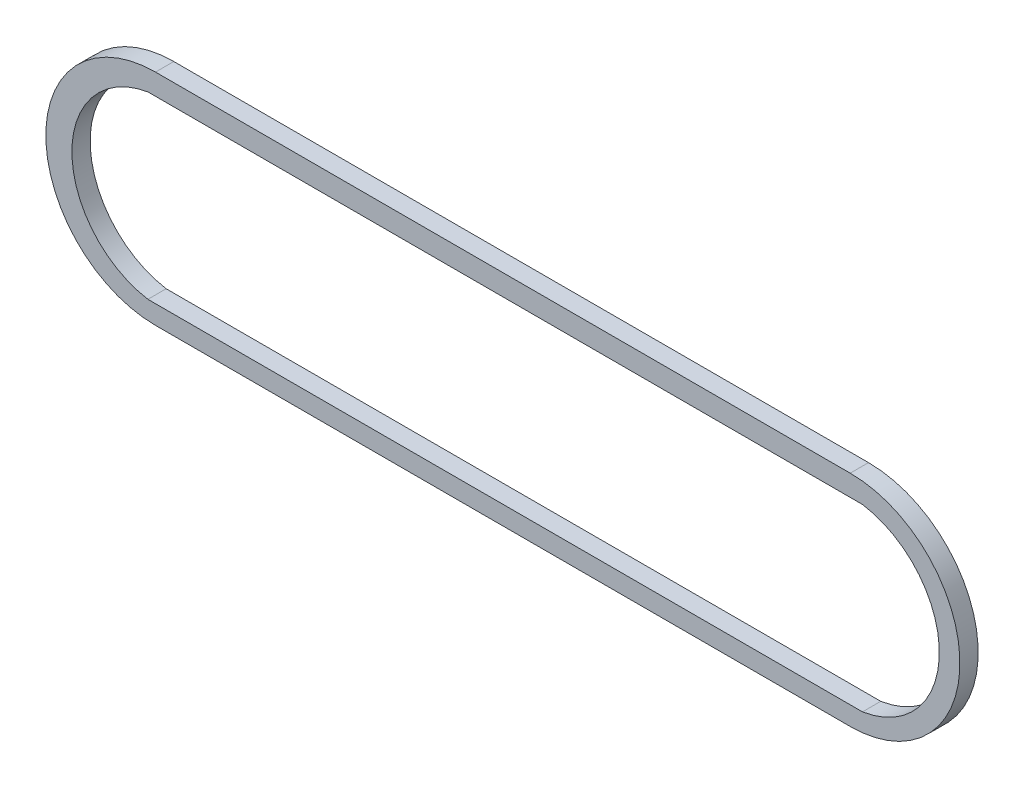
from build123d import *

# Parameters (mm, degrees)
SKETCH_1_W          = 500
SKETCH_1_H          = 120
EXTRUDE_1_DEPTH     = 10
FILLET_8_RADIUS     = 60
FILLET_8_LENGTH     = 10
FILLET_9_RADIUS     = 60
FILLET_9_LENGTH     = 10
CUT_EXTRUDE_1_DEPTH = 10


with BuildPart() as part:
    # 草图1 → 凸台-拉伸1 (new body)
    with BuildSketch(Plane.XY):
        with Locations((176.447257932, 35.78698553)):
            Rectangle(SKETCH_1_W, SKETCH_1_H)
    extrude(amount=EXTRUDE_1_DEPTH)

    # 圆角8: full round fillet: the end face becomes a half cylinder, R = half its width
    fillet_8_face = Plane((-73.552742068, 35.78698553, 5), x_dir=(0, 0, -1), z_dir=(-1, 0, 0))  # on the end face: x along it, z out of the body
    fillet_8_slab = fillet_8_face.offset(-FILLET_8_RADIUS / 2) * Box(FILLET_8_LENGTH, 2 * FILLET_8_RADIUS, FILLET_8_RADIUS, mode=Mode.PRIVATE)  # the body's end, R deep
    fillet_8_round = Plane((-13.552742068, 35.78698553, 5), x_dir=(-1, 0, 0), z_dir=(0, 0, -1)) * Cylinder(FILLET_8_RADIUS, FILLET_8_LENGTH, mode=Mode.PRIVATE)  # its axis R under the face
    add(fillet_8_slab - fillet_8_round, mode=Mode.SUBTRACT)

    # 圆角9: full round fillet: the end face becomes a half cylinder, R = half its width
    fillet_9_face = Plane((426.447257932, 35.78698553, 5), x_dir=(0, 0, 1), z_dir=(1, 0, 0))  # on the end face: x along it, z out of the body
    fillet_9_slab = fillet_9_face.offset(-FILLET_9_RADIUS / 2) * Box(FILLET_9_LENGTH, 2 * FILLET_9_RADIUS, FILLET_9_RADIUS, mode=Mode.PRIVATE)  # the body's end, R deep
    fillet_9_round = Plane((366.447257932, 35.78698553, 5), x_dir=(1, 0, 0), z_dir=(0, 0, 1)) * Cylinder(FILLET_9_RADIUS, FILLET_9_LENGTH, mode=Mode.PRIVATE)  # its axis R under the face
    add(fillet_9_slab - fillet_9_round, mode=Mode.SUBTRACT)

    # 草图4 → 切除-拉伸1 (cut)
    with BuildSketch(Plane.XY.offset(10)):
        with BuildLine():
            Line((-17.715997056, 84.303216301), (373.153004855, 84.303216301))
            ThreePointArc((373.153004855, 84.303216301), (415.190496712, 35.186079817), (373.153004855, -13.931056666))
            Line((373.153004855, -13.931056666), (-17.715997056, -13.931056666))
            ThreePointArc((-17.715997056, -13.931056666), (-59.295663847, 35.186079817), (-17.715997056, 84.303216301))
        make_face()
    extrude(amount=-CUT_EXTRUDE_1_DEPTH, mode=Mode.SUBTRACT)


solid = part.part
